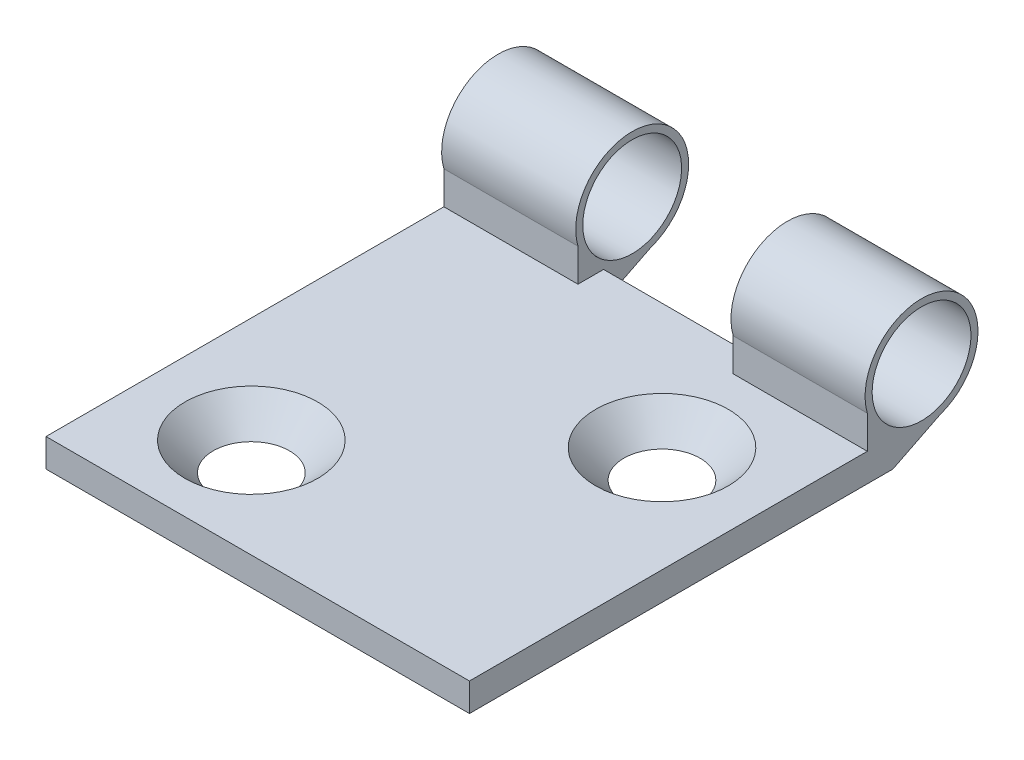
from build123d import *

# Parameters (mm, degrees)
SKETCH_1_W                  = 30
SKETCH_1_H                  = 30
EXTRUDE_1_DEPTH             = 2
SKETCH_2_R                  = 4
EXTRUDE_2_DEPTH             = 9.5
SKETCH_3_R                  = 4
EXTRUDE_3_DEPTH             = 9.5
CUT_EXTRUDE_START           = -30
SKETCH_4_R                  = 3.5
CUT_EXTRUDE_1_DEPTH         = 30
EXTRUDE_4_DEPTH             = 9.5
EXTRUDE_START               = -9.5
EXTRUDE_5_DEPTH             = 9.5
HOLE_WIZARD_M41_D           = 4.5
HOLE_WIZARD_M41_DEPTH       = 21
HOLE_WIZARD_M41_CSINK_D     = 9.4
HOLE_WIZARD_M41_CSINK_ANGLE = 90
HOLE_WIZARD_M41_TIP         = 1.351936393


with BuildPart() as part:
    # Эскиз1 → Бобышка-Вытянуть1 (new body)
    with BuildSketch(Plane(origin=(0, 0, 0), x_dir=(1, 0, 0), z_dir=(0, 1, 0))):
        with Locations((-70.332590066, -54.606104746)):
            Rectangle(SKETCH_1_W, SKETCH_1_H)
    extrude(amount=EXTRUDE_1_DEPTH)



with BuildPart() as body_2:
    # Эскиз2 → Бобышка-Вытянуть2 (new body)
    with BuildSketch(Plane.ZY.offset(85.332590066)):
        with Locations((37.577272985, 5.447294836)):
            Circle(SKETCH_2_R)
    extrude(amount=-EXTRUDE_2_DEPTH)


with BuildPart() as body_3:
    # Эскиз3 → Бобышка-Вытянуть3 (new body)
    with BuildSketch(Plane.ZY.offset(64.832590066)):
        with Locations((37.577272985, 5.447294836)):
            Circle(SKETCH_3_R)
    extrude(amount=-EXTRUDE_3_DEPTH)


with BuildPart() as cut_extrude_1_tool:
    # Эскиз4 → Вырез-Вытянуть1 (new body)
    with BuildSketch(Plane.ZY.offset(85.332590066).offset(CUT_EXTRUDE_START)):
        with Locations((37.577272985, 5.447294836)):
            Circle(SKETCH_4_R)
    extrude(amount=CUT_EXTRUDE_1_DEPTH)


with BuildPart() as body_2_1:
    add(body_2.part)

    # Вырез-Вытянуть1: cut by cut_extrude_1_tool
    add(cut_extrude_1_tool.part, mode=Mode.SUBTRACT)


with BuildPart() as body_3_1:
    add(body_3.part)

    # Вырез-Вытянуть1: cut by cut_extrude_1_tool
    add(cut_extrude_1_tool.part, mode=Mode.SUBTRACT)


with BuildPart() as part_1:
    add(part.part)

    add(body_2_1.part)  # Бобышка-Вытянуть4 merges body 2
    # Эскиз5 → Бобышка-Вытянуть4 (add)
    with BuildSketch(Plane.ZY.offset(85.332590066)):
        with BuildLine():
            Line((39.606104746, 0), (36.267042135, 1.667970145))
            ThreePointArc((36.267042135, 1.667970145), (39.413946145, 1.89389763), (41.418204347, 4.330493028))
            Line((41.418204347, 4.330493028), (41.418204347, 0))
            Line((41.418204347, 0), (39.606104746, 0))
        make_face()
    extrude(amount=-EXTRUDE_4_DEPTH)


    add(body_3_1.part)  # Бобышка-Вытянуть5 merges body 3
    # Эскиз6 → Бобышка-Вытянуть5 (add)
    with BuildSketch(Plane.ZY.offset(64.832590066).offset(EXTRUDE_START)):
        with BuildLine():
            Line((41.418204347, 2), (41.418204347, 4.330493028))
            Line((41.418204347, 4.330493028), (40.83906741, 4.178162405))
            ThreePointArc((40.83906741, 4.178162405), (39.143105824, 2.317092363), (36.636762804, 2.076027923))
            Line((36.636762804, 2.076027923), (36.267042135, 1.667970145))
            Line((36.267042135, 1.667970145), (39.606104746, 0))
            Line((39.606104746, 0), (41.418204347, 2))
        make_face()
    extrude(amount=EXTRUDE_5_DEPTH)

    # Зенковка для  винта с плоской головкой M41
    with Locations(Plane(origin=(0, 2, 0), x_dir=(1, 0, 0), z_dir=(0, 1, 0))):
        with Locations((-62.832590066, -48.465179446), (-77.832590066, -62.559129646)):
            CounterSinkHole(HOLE_WIZARD_M41_D / 2, HOLE_WIZARD_M41_CSINK_D / 2, depth=HOLE_WIZARD_M41_DEPTH, counter_sink_angle=HOLE_WIZARD_M41_CSINK_ANGLE)
            with Locations((0, 0, -(HOLE_WIZARD_M41_DEPTH + HOLE_WIZARD_M41_TIP / 2))):  # 118° drill point
                Cone(0, HOLE_WIZARD_M41_D / 2, HOLE_WIZARD_M41_TIP, mode=Mode.SUBTRACT)


solid = part_1.part
